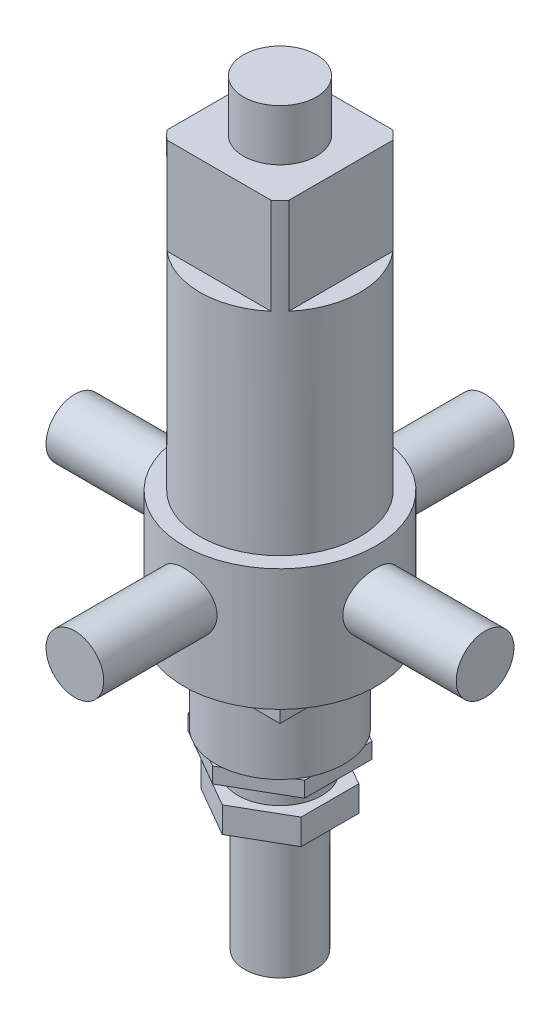
from build123d import *

# Parameters (mm, degrees)
SKETCH_3_R           = 14.347327659
SKETCH_3_W           = 19
SKETCH_3_H           = 19
CUT_EXTRUDE_1_DEPTH  = 15
SKETCH_4_R           = 9.80838312
CUT_EXTRUDE_2_DEPTH  = 4
SKETCH_5_R           = 11.664818178
CUT_EXTRUDE_3_DEPTH  = 2.424756107
SKETCH_6_R           = 18.248215306
SKETCH_6_W           = 19
SKETCH_6_H           = 19
CUT_EXTRUDE_4_DEPTH  = 3
EXTRUDE_1_DEPTH      = 17
EXTRUDE_1_DEPTH_BACK = 47
SKETCH_8_R           = 4.5
SKETCH_9_R           = 5.7
EXTRUDE_2_DEPTH      = 8
EXTRUDE_3_DEPTH      = 32
EXTRUDE_3_DEPTH_BACK = 32
SKETCH_10_R          = 4.5


with BuildPart() as part:
    # Эскиз2 → Повернуть1 (revolve)
    with BuildSketch(Plane.XY, mode=Mode.PRIVATE) as revolve_1_sk:
        Polygon((0, 110), (12.5, 110), (12.5, 62), (15, 62), (15, 40), (10, 40), (10, 30), (10.5, 30), (10.5, 27.575243893), (6.508274003, 27.575243893), (6.508274003, 24), (9, 24), (9, 20), (5.5, 20), (5.5, 0), (0, 0), align=None)
    revolve(revolve_1_sk.sketch.rotate(Axis((0, 0, 0), (0, 1, 0)), 90), axis=Axis((0, 0, 0), (0, 1, 0)))

    # Эскиз3 → Вырез-Вытянуть1 (cut)
    with BuildSketch(Plane(origin=(0, 110, 0), x_dir=(1, 0, 0), z_dir=(0, 1, 0))):
        Circle(SKETCH_3_R)
        Rectangle(SKETCH_3_W, SKETCH_3_H, mode=Mode.SUBTRACT)
    extrude(amount=-CUT_EXTRUDE_1_DEPTH, mode=Mode.SUBTRACT)

    # Эскиз4 → Вырез-Вытянуть2 (cut)
    with BuildSketch(Plane.XZ.offset(-20)):
        Circle(SKETCH_4_R)
        Polygon((0, 9), (-7.794228634, 4.5), (-7.794228634, -4.5), (0, -9), (7.794228634, -4.5), (7.794228634, 4.5), align=None, mode=Mode.SUBTRACT)
    extrude(amount=-CUT_EXTRUDE_2_DEPTH, mode=Mode.SUBTRACT)

    # Эскиз5 → Вырез-Вытянуть3 (cut)
    with BuildSketch(Plane.XZ.offset(-27.575243893)):
        Circle(SKETCH_5_R)
        Polygon((0, 10.5), (-9.09326674, 5.25), (-9.09326674, -5.25), (0, -10.5), (9.09326674, -5.25), (9.09326674, 5.25), align=None, mode=Mode.SUBTRACT)
    extrude(amount=-CUT_EXTRUDE_3_DEPTH, mode=Mode.SUBTRACT)

    # Эскиз6 → Вырез-Вытянуть4 (cut)
    with BuildSketch(Plane.XZ.offset(-40)):
        Circle(SKETCH_6_R)
        Rectangle(SKETCH_6_W, SKETCH_6_H, mode=Mode.SUBTRACT)
    extrude(amount=-CUT_EXTRUDE_4_DEPTH, mode=Mode.SUBTRACT)

    # Эскиз9 → Бобышка-Вытянуть2 (add)
    with BuildSketch(Plane(origin=(0, 110, 0), x_dir=(1, 0, 0), z_dir=(0, 1, 0))):
        with Locations(Location((0, 0, 0), (0, 0, 270))):
            Circle(SKETCH_9_R)
    extrude(amount=EXTRUDE_2_DEPTH)



with BuildPart() as body_2:
    # Эскиз8 → Бобышка-Вытянуть1 (new, two sides: drawn at the far end of the back side and taken through both)
    with BuildSketch(Plane.XY.offset(15).offset(-EXTRUDE_1_DEPTH_BACK)):
        with Locations((0, 54.5)):
            Circle(SKETCH_8_R)
    extrude(amount=EXTRUDE_1_DEPTH + EXTRUDE_1_DEPTH_BACK)


with BuildPart() as part_1:
    add(part.part)

    add(body_2.part)  # Бобышка-Вытянуть3 merges body 2
    # Эскиз10 → Бобышка-Вытянуть3 (add, two sides: drawn at the far end of the back side and taken through both)
    with BuildSketch(Plane(origin=(0, 0, 0), x_dir=(0, 0, -1), z_dir=(1, 0, 0)).offset(-EXTRUDE_3_DEPTH_BACK)):
        with Locations((0, 54.5)):
            Circle(SKETCH_10_R)
    extrude(amount=EXTRUDE_3_DEPTH + EXTRUDE_3_DEPTH_BACK)


solid = part_1.part
